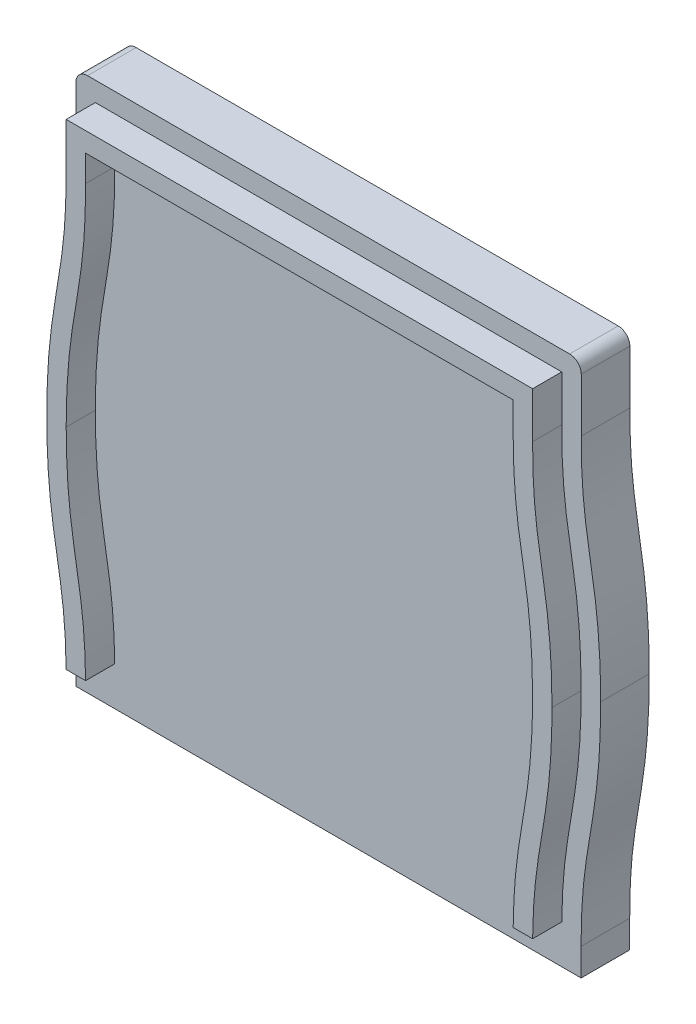
from build123d import *

# Parameters (mm, degrees)
BOSS_EXTRUDE1_DEPTH = 3
BOSS_EXTRUDE2_DEPTH = 5
FILLET7_R           = 1.2
CUT_EXTRUDE1_DEPTH  = 3
SKETCH9_W           = 49.989585209
SKETCH9_H           = 4
CUT_EXTRUDE2_DEPTH  = 3


with BuildPart() as part:
    # Sketch1 → Boss-Extrude1 (new body)
    with BuildSketch(Plane.XY):
        with BuildLine():
            Line((28.005207395, 53.01980246), (28.005207395, 0))
            Line((28.005207395, 0), (52, 0))
            Line((52, 0), (52, 2.9146477))
            add(Edge.make_bspline(
                [(54, 25.607527289), (54, 25.159169522), (53.994288647, 24.283360938), (53.944437462, 22.364816973), (53.80644817, 19.846772797), (53.457239701, 16.735076854), (52.97052622, 13.830588939), (52.553998709, 11.322953348), (52.298218213, 9.357304832), (52.147846123, 7.65276951), (52.064355406, 6.263182374), (52.020871116, 4.967378593), (52.003043675, 3.838316022), (52, 3.217882336), (52, 2.9146477)],
                knots=[0, 0, 0, 0, 0.062770413, 0.125540826, 0.251081651, 0.376622477, 0.502163302, 0.627704128, 0.753244954, 0.816015366, 0.878785779, 0.941556192, 0.972941398, 1.004326605, 1.004326605, 1.004326605, 1.004326605], degree=3))
            add(Edge.make_bspline(
                [(52.005207395, 48.302981133), (52.005032478, 47.999820298), (52.007704017, 47.379593464), (52.024798321, 46.250449069), (52.067339722, 44.954106741), (52.149671224, 43.56346429), (52.298420576, 41.857666135), (52.552090867, 39.891444934), (52.96513006, 37.389942775), (53.450176666, 34.49275873), (53.802371878, 31.383762001), (53.942389857, 28.862532812), (53.993270646, 26.94036246), (54.000260154, 26.05841638), (54, 25.607527289)],
                knots=[0, 0, 0, 0, 0.03125, 0.0625, 0.125, 0.1875, 0.25, 0.375, 0.5, 0.625, 0.75, 0.875, 0.9375, 1, 1, 1, 1], degree=3))
            Line((52.005207395, 48.302981133), (52.005207395, 53.01980246))
            Line((52.005207395, 53.01980246), (28.005207395, 53.01980246))
        make_face()
    boss_extrude1 = extrude(amount=BOSS_EXTRUDE1_DEPTH)

    # Mirror3: Boss-Extrude1 across plane
    add(boss_extrude1.mirror(Plane(origin=(28.005207395, 53.01980246, 3), x_dir=(0, 0, 1), z_dir=(1, 0, 0))))

    # Sketch8 → Cut-Extrude1 (cut)
    with BuildSketch(Plane.XY.offset(3)):
        with BuildLine():
            add(Edge.make_bspline(
                [(50, 2.9146477), (50, 3.224617501), (50.00310159, 3.857879479), (50.021398068, 5.017732873), (50.066192084, 6.354112543), (50.152974511, 7.799621089), (50.309893415, 9.578663007), (50.576683671, 11.626438016), (51.000941524, 14.177508821), (51.476890427, 17.021040342), (51.811938615, 20.009813081), (51.945914224, 22.44899251), (51.99445353, 24.316126277), (52, 25.170862419), (52, 25.608104268)],
                knots=[0, 0, 0, 0, 0.031386048, 0.062772096, 0.125544191, 0.188316287, 0.251088383, 0.376632574, 0.502176765, 0.627720957, 0.753265148, 0.878809339, 0.941581435, 1.004353531, 1.004353531, 1.004353531, 1.004353531], degree=3))
            add(Edge.make_bspline(
                [(52, 25.608104268), (52.000253167, 26.046883682), (51.993484197, 26.90461728), (51.943891847, 28.778318851), (51.808041336, 31.218153583), (51.470046418, 34.205615138), (50.995363085, 37.044048854), (50.574458042, 39.589997462), (50.309894836, 41.638165834), (50.154689303, 43.418158771), (50.069126253, 44.864352209), (50.025303755, 46.201018799), (50.007755855, 47.360709732), (50.005030547, 47.993698971), (50.005207395, 48.303554977)],
                knots=[-2.6659e-05, -2.6659e-05, -2.6659e-05, -2.6659e-05, 0.062473788, 0.124974235, 0.249975129, 0.374976024, 0.499976918, 0.624977813, 0.749978707, 0.812479154, 0.874979602, 0.937480049, 0.968730272, 0.999980496, 0.999980496, 0.999980496, 0.999980496], degree=3))
            Line((50.005207395, 48.303554977), (50.005207395, 51.01980246))
            Line((50.005207395, 51.01980246), (6.005207395, 51.01980246))
            Line((6.005207395, 51.01980246), (6.005207395, 48.303554977))
            add(Edge.make_bspline(
                [(6.005207395, 48.303554977), (6.005384244, 47.993698971), (6.002658935, 47.360709732), (5.985111036, 46.201018799), (5.941288538, 44.864352209), (5.855725488, 43.418158771), (5.700519955, 41.638165834), (5.435956749, 39.589997462), (5.015051706, 37.044048854), (4.540368373, 34.205615138), (4.202373454, 31.218153583), (4.066522943, 28.778318851), (4.016930594, 26.90461728), (4.010161624, 26.046883682), (4.010414791, 25.608104268)],
                knots=[1.9504e-05, 1.9504e-05, 1.9504e-05, 1.9504e-05, 0.031269728, 0.062519951, 0.125020398, 0.187520846, 0.250021293, 0.375022187, 0.500023082, 0.625023976, 0.750024871, 0.875025765, 0.937526212, 1.000026659, 1.000026659, 1.000026659, 1.000026659], degree=3))
            add(Edge.make_bspline(
                [(4.010414791, 25.608104268), (4.010414791, 25.170862419), (4.01596126, 24.316126277), (4.064500566, 22.44899251), (4.198476176, 20.009813081), (4.533524364, 17.021040342), (5.009473266, 14.177508821), (5.433731119, 11.626438016), (5.700521375, 9.578663007), (5.85744028, 7.799621089), (5.944222707, 6.354112543), (5.989016723, 5.017732873), (6.007313201, 3.857879479), (6.010414791, 3.224617501), (6.010414791, 2.9146477)],
                knots=[-2.6926e-05, -2.6926e-05, -2.6926e-05, -2.6926e-05, 0.06274517, 0.125517265, 0.251061457, 0.376605648, 0.50214984, 0.627694031, 0.753238222, 0.816010318, 0.878782414, 0.941554509, 0.972940557, 1.004326605, 1.004326605, 1.004326605, 1.004326605], degree=3))
            Line((6.010414791, 2.9146477), (6.010414791, 2))
            Line((6.010414791, 2), (50, 2))
            Line((50, 2), (50, 2.9146477))
        make_face()
    extrude(amount=-CUT_EXTRUDE1_DEPTH, mode=Mode.SUBTRACT)

    # Sketch9 → Cut-Extrude2 (cut)
    with BuildSketch(Plane.XY.offset(3)):
        with Locations((28.005207396, 2)):
            Rectangle(SKETCH9_W, SKETCH9_H)
    extrude(amount=-CUT_EXTRUDE2_DEPTH, mode=Mode.SUBTRACT)


with BuildPart() as body_2:
    # Sketch7 → Boss-Extrude2 (new body)
    with BuildSketch(Plane(origin=(0, 0, 0), x_dir=(-1, 0, 0), z_dir=(0, 0, -1))):
        with BuildLine():
            Line((-54, 0), (-2.010414791, 0))
            Line((-2.010414791, 0), (-2.010414791, 2.826684811))
            add(Edge.make_bspline(
                [(-0.002683346, 25.607288768), (-0.002684793, 25.146020337), (-0.008578722, 24.24562844), (-0.059938428, 22.268024705), (-0.202488874, 19.660991127), (-0.567266614, 16.413790423), (-1.066667382, 13.436844707), (-1.477049301, 10.963058588), (-1.722769034, 9.072207085), (-1.867151188, 7.435831234), (-1.947659771, 6.096972052), (-1.989995849, 4.836856595), (-2.007419417, 3.734309195), (-2.010415452, 3.12433851), (-2.010414791, 2.826684811)],
                knots=[0, 0, 0, 0, 0.062768763, 0.125537527, 0.251075054, 0.376612581, 0.502150108, 0.627687635, 0.753225162, 0.815993925, 0.878762689, 0.941531452, 0.972915834, 1.004300216, 1.004300216, 1.004300216, 1.004300216], degree=3))
            add(Edge.make_bspline(
                [(-2.005207395, 48.390705962), (-2.005278243, 48.093051791), (-2.002433581, 47.483064625), (-1.985280271, 46.380599958), (-1.94326327, 45.120314638), (-1.863091302, 43.781324125), (-1.719150663, 42.144803769), (-1.473867053, 40.253375363), (-1.064356832, 37.781388755), (-0.565858313, 34.803786135), (-0.201274319, 31.559573525), (-0.0594386, 28.949039647), (-0.008356002, 26.978566135), (-0.002573008, 26.070855192), (-0.002683346, 25.607288768)],
                knots=[-0.004037615, -0.004037615, -0.004037615, -0.004037615, 0.02733918, 0.058715975, 0.121469565, 0.184223155, 0.246976745, 0.372483925, 0.497991105, 0.623498285, 0.749005465, 0.874512645, 0.937266235, 1.000019825, 1.000019825, 1.000019825, 1.000019825], degree=3))
            Line((-2.005207395, 48.390705962), (-2.005207395, 55.01980246))
            Line((-2.005207395, 55.01980246), (-54.012879472, 55.01980246))
            Line((-54.012879472, 55.01980246), (-54.012879472, 48.302067423))
            add(Edge.make_bspline(
                [(-56.007672007, 25.60661437), (-56.007935943, 26.069619097), (-56.000730175, 26.975794719), (-55.948558309, 28.94642677), (-55.804371941, 31.549073699), (-55.437972012, 34.779609337), (-54.942570943, 37.735488393), (-54.537399908, 40.192530107), (-54.294622311, 42.076793881), (-54.152327736, 43.708398737), (-54.073226386, 45.043493604), (-54.031965992, 46.299521463), (-54.01532357, 47.39811745), (-54.012708414, 48.005596422), (-54.012879472, 48.302067423)],
                knots=[2.6056e-05, 2.6056e-05, 2.6056e-05, 2.6056e-05, 0.062525666, 0.125025277, 0.250024498, 0.375023719, 0.50002294, 0.625022162, 0.750021383, 0.812520993, 0.875020604, 0.937520215, 0.96877002, 1.000019825, 1.000019825, 1.000019825, 1.000019825], degree=3))
            add(Edge.make_bspline(
                [(-54, 2.826684811), (-54.000100255, 3.124370242), (-54.003315975, 3.734490867), (-54.021186519, 4.836633544), (-54.064120608, 6.096118397), (-54.145395663, 7.433673192), (-54.290876521, 9.068619606), (-54.53817552, 10.959362089), (-54.951355009, 13.438696093), (-55.451864372, 16.426002046), (-55.813260339, 19.674055379), (-55.952995542, 22.278826171), (-56.002879294, 24.248395477), (-56.0075171, 25.146652354), (-56.007672007, 25.60661437)],
                knots=[0, 0, 0, 0, 0.031513139, 0.063026278, 0.126052556, 0.189078835, 0.252105113, 0.378157669, 0.504210226, 0.630262782, 0.756315339, 0.882367895, 0.945394173, 1.008420451, 1.008420451, 1.008420451, 1.008420451], degree=3))
            Line((-54, 2.826684811), (-54, 0))
        make_face()
    extrude(amount=BOSS_EXTRUDE2_DEPTH)

    # Fillet7
    fillet7_edges = [body_2.edges().sort_by_distance(p)[0] for p in [
        (54.012879472, 55.01980246, -2.5),
        (2.005207395, 55.01980246, -2.5),
    ]]
    fillet(fillet7_edges, radius=FILLET7_R)


solid = Compound([part.part, body_2.part])
